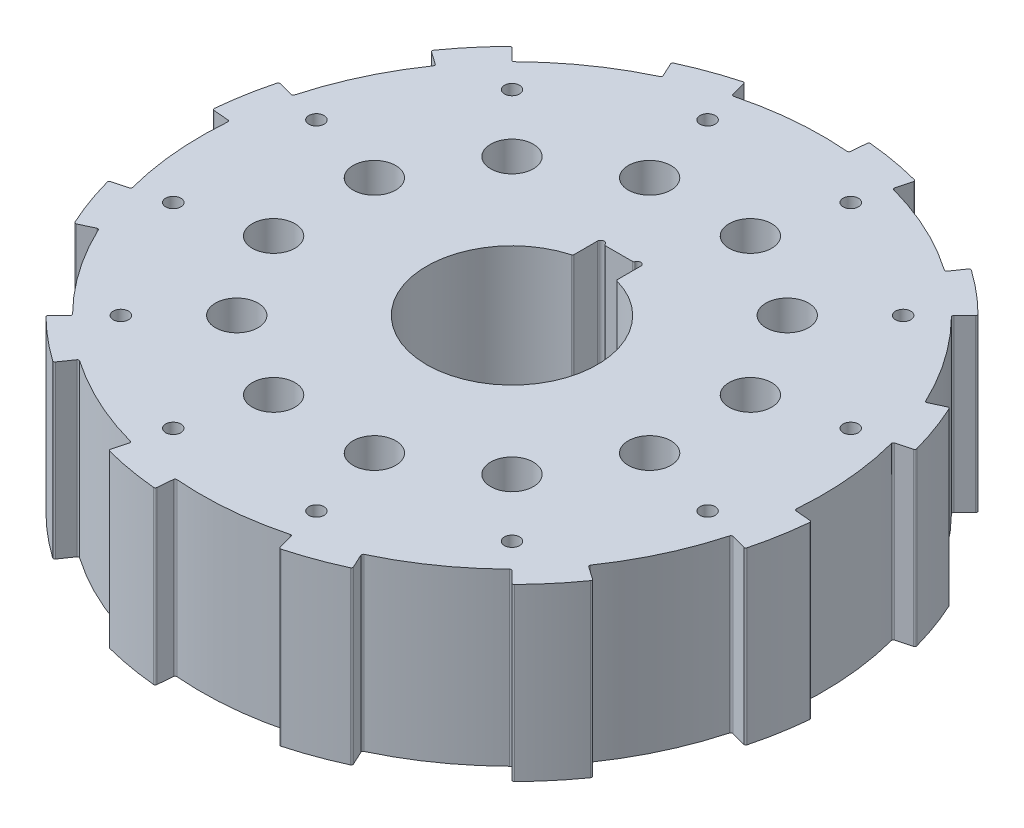
from build123d import *

# Parameters (mm, degrees)
SKETCH1_R           = 3.175
SKETCH1_R_2         = 1.1303
BOSS_EXTRUDE2_DEPTH = 25.4


with BuildPart() as part:
    # Sketch1 → Boss-Extrude2 (new body)
    with BuildSketch(Plane(origin=(0, 0, 0), x_dir=(1, 0, 0), z_dir=(0, 1, 0))):
        with BuildLine():
            Line((4.051112749, 46.304430603), (4.250353612, 48.581764091))
            ThreePointArc((4.250353612, 48.581764091), (4.340626274, 48.75462634), (4.526842206, 48.812541254))
            ThreePointArc((4.526842206, 48.812541254), (8.512578924, 48.277246028), (12.441028128, 47.41705709))
            ThreePointArc((12.441028128, 47.41705709), (12.59620747, 47.298942373), (12.621910232, 47.105626356))
            Line((12.621910232, 47.105626356), (12.03025003, 44.897519881))
            ThreePointArc((12.03025003, 44.897519881), (12.055281097, 44.705361767), (12.208533547, 44.586765891))
            ThreePointArc((12.208533547, 44.586765891), (19.536806819, 41.896791802), (26.307967962, 38.012087626))
            ThreePointArc((26.307967962, 38.012087626), (26.497307157, 37.970925526), (26.660581856, 38.075256836))
            Line((26.660581856, 38.075256836), (27.971796248, 39.947865057))
            ThreePointArc((27.971796248, 39.947865057), (28.136405792, 40.052431825), (28.326630976, 40.009479646))
            ThreePointArc((28.326630976, 40.009479646), (31.510732614, 37.553032023), (34.482774953, 34.843861949))
            ThreePointArc((34.482774953, 34.843861949), (34.558106847, 34.663981932), (34.483708083, 34.483713969))
            Line((34.483708083, 34.483713969), (32.86726208, 32.867267769))
            ThreePointArc((32.86726208, 32.867267769), (32.792860563, 32.688338427), (32.86628314, 32.509005161))
            ThreePointArc((32.86628314, 32.509005161), (37.867766915, 26.515282628), (41.78941239, 19.765449554))
            ThreePointArc((41.78941239, 19.765449554), (41.932803893, 19.635132532), (42.126369585, 19.643848748))
            Line((42.126369585, 19.643848748), (44.198218669, 20.609967842))
            ThreePointArc((44.198218669, 20.609967842), (44.393058099, 20.618220548), (44.536321852, 20.485910277))
            ThreePointArc((44.536321852, 20.485910277), (46.065610947, 16.766513415), (47.284890077, 12.934282137))
            ThreePointArc((47.284890077, 12.934282137), (47.260189402, 12.740835526), (47.105624201, 12.621918273))
            Line((47.105624201, 12.621918273), (44.897517799, 12.030257801))
            ThreePointArc((44.897517799, 12.030257801), (44.743619524, 11.912501204), (44.717538708, 11.720482751))
            ThreePointArc((44.717538708, 11.720482751), (46.052089447, 4.029024887), (46.073417516, -3.777324764))
            ThreePointArc((46.073417516, -3.777324764), (46.132439689, -3.961878367), (46.304430603, -4.051112749))
            Line((46.304430603, -4.051112749), (48.581764091, -4.250353612))
            ThreePointArc((48.581764091, -4.250353612), (48.75462634, -4.340626274), (48.812541254, -4.526842206))
            ThreePointArc((48.812541254, -4.526842206), (48.277246028, -8.512578924), (47.41705709, -12.441028128))
            ThreePointArc((47.41705709, -12.441028128), (47.298942373, -12.59620747), (47.105626356, -12.621910232))
            Line((47.105626356, -12.621910232), (44.897519881, -12.03025003))
            ThreePointArc((44.897519881, -12.03025003), (44.705361767, -12.055281097), (44.586765891, -12.208533547))
            ThreePointArc((44.586765891, -12.208533547), (41.896791802, -19.536806819), (38.012087626, -26.307967962))
            ThreePointArc((38.012087626, -26.307967962), (37.970925526, -26.497307157), (38.075256836, -26.660581856))
            Line((38.075256836, -26.660581856), (39.947865057, -27.971796248))
            ThreePointArc((39.947865057, -27.971796248), (40.052431825, -28.136405792), (40.009479646, -28.326630976))
            ThreePointArc((40.009479646, -28.326630976), (37.553032023, -31.510732614), (34.843861949, -34.482774953))
            ThreePointArc((34.843861949, -34.482774953), (34.663981932, -34.558106847), (34.483713969, -34.483708083))
            Line((34.483713969, -34.483708083), (32.867267769, -32.86726208))
            ThreePointArc((32.867267769, -32.86726208), (32.688338427, -32.792860563), (32.509005161, -32.86628314))
            ThreePointArc((32.509005161, -32.86628314), (26.515282628, -37.867766915), (19.765449554, -41.78941239))
            ThreePointArc((19.765449554, -41.78941239), (19.635132532, -41.932803893), (19.643848748, -42.126369585))
            Line((19.643848748, -42.126369585), (20.609967842, -44.198218669))
            ThreePointArc((20.609967842, -44.198218669), (20.618220548, -44.393058099), (20.485910277, -44.536321852))
            ThreePointArc((20.485910277, -44.536321852), (16.766513415, -46.065610947), (12.934282137, -47.284890077))
            ThreePointArc((12.934282137, -47.284890077), (12.740835526, -47.260189402), (12.621918273, -47.105624201))
            Line((12.621918273, -47.105624201), (12.030257801, -44.897517799))
            ThreePointArc((12.030257801, -44.897517799), (11.912501204, -44.743619524), (11.720482751, -44.717538708))
            ThreePointArc((11.720482751, -44.717538708), (4.029024887, -46.052089447), (-3.777324764, -46.073417516))
            ThreePointArc((-3.777324764, -46.073417516), (-3.961878367, -46.132439689), (-4.051112749, -46.304430603))
            Line((-4.051112749, -46.304430603), (-4.250353612, -48.581764091))
            ThreePointArc((-4.250353612, -48.581764091), (-4.340626274, -48.75462634), (-4.526842206, -48.812541254))
            ThreePointArc((-4.526842206, -48.812541254), (-8.512578924, -48.277246028), (-12.441028128, -47.41705709))
            ThreePointArc((-12.441028128, -47.41705709), (-12.59620747, -47.298942373), (-12.621910232, -47.105626356))
            Line((-12.621910232, -47.105626356), (-12.03025003, -44.897519881))
            ThreePointArc((-12.03025003, -44.897519881), (-12.055281097, -44.705361767), (-12.208533547, -44.586765891))
            ThreePointArc((-12.208533547, -44.586765891), (-19.536806819, -41.896791802), (-26.307967962, -38.012087626))
            ThreePointArc((-26.307967962, -38.012087626), (-26.497307157, -37.970925526), (-26.660581856, -38.075256836))
            Line((-26.660581856, -38.075256836), (-27.971796248, -39.947865057))
            ThreePointArc((-27.971796248, -39.947865057), (-28.136405792, -40.052431825), (-28.326630976, -40.009479646))
            ThreePointArc((-28.326630976, -40.009479646), (-31.510732614, -37.553032023), (-34.482774953, -34.843861949))
            ThreePointArc((-34.482774953, -34.843861949), (-34.558106847, -34.663981932), (-34.483708083, -34.483713969))
            Line((-34.483708083, -34.483713969), (-32.86726208, -32.867267769))
            ThreePointArc((-32.86726208, -32.867267769), (-32.792860563, -32.688338427), (-32.86628314, -32.509005161))
            ThreePointArc((-32.86628314, -32.509005161), (-37.867766915, -26.515282628), (-41.78941239, -19.765449554))
            ThreePointArc((-41.78941239, -19.765449554), (-41.932803893, -19.635132532), (-42.126369585, -19.643848748))
            Line((-42.126369585, -19.643848748), (-44.198218669, -20.609967842))
            ThreePointArc((-44.198218669, -20.609967842), (-44.393058099, -20.618220548), (-44.536321852, -20.485910277))
            ThreePointArc((-44.536321852, -20.485910277), (-46.065610947, -16.766513415), (-47.284890077, -12.934282137))
            ThreePointArc((-47.284890077, -12.934282137), (-47.260189402, -12.740835526), (-47.105624201, -12.621918273))
            Line((-47.105624201, -12.621918273), (-44.897517799, -12.030257801))
            ThreePointArc((-44.897517799, -12.030257801), (-44.743619524, -11.912501204), (-44.717538708, -11.720482751))
            ThreePointArc((-44.717538708, -11.720482751), (-46.052089447, -4.029024887), (-46.073417516, 3.777324764))
            ThreePointArc((-46.073417516, 3.777324764), (-46.132439689, 3.961878367), (-46.304430603, 4.051112749))
            Line((-46.304430603, 4.051112749), (-48.581764091, 4.250353612))
            ThreePointArc((-48.581764091, 4.250353612), (-48.75462634, 4.340626274), (-48.812541254, 4.526842206))
            ThreePointArc((-48.812541254, 4.526842206), (-48.277246028, 8.512578924), (-47.41705709, 12.441028128))
            ThreePointArc((-47.41705709, 12.441028128), (-47.298942373, 12.59620747), (-47.105626356, 12.621910232))
            Line((-47.105626356, 12.621910232), (-44.897519881, 12.03025003))
            ThreePointArc((-44.897519881, 12.03025003), (-44.705361767, 12.055281097), (-44.586765891, 12.208533547))
            ThreePointArc((-44.586765891, 12.208533547), (-41.896791802, 19.536806819), (-38.012087626, 26.307967962))
            ThreePointArc((-38.012087626, 26.307967962), (-37.970925526, 26.497307157), (-38.075256836, 26.660581856))
            Line((-38.075256836, 26.660581856), (-39.947865057, 27.971796248))
            ThreePointArc((-39.947865057, 27.971796248), (-40.052431825, 28.136405792), (-40.009479646, 28.326630976))
            ThreePointArc((-40.009479646, 28.326630976), (-37.553032023, 31.510732614), (-34.843861949, 34.482774953))
            ThreePointArc((-34.843861949, 34.482774953), (-34.663981932, 34.558106847), (-34.483713969, 34.483708083))
            Line((-34.483713969, 34.483708083), (-32.867267769, 32.86726208))
            ThreePointArc((-32.867267769, 32.86726208), (-32.688338427, 32.792860563), (-32.509005161, 32.86628314))
            ThreePointArc((-32.509005161, 32.86628314), (-26.515282628, 37.867766915), (-19.765449554, 41.78941239))
            ThreePointArc((-19.765449554, 41.78941239), (-19.635132532, 41.932803893), (-19.643848748, 42.126369585))
            Line((-19.643848748, 42.126369585), (-20.609967842, 44.198218669))
            ThreePointArc((-20.609967842, 44.198218669), (-20.618220548, 44.393058099), (-20.485910277, 44.536321852))
            ThreePointArc((-20.485910277, 44.536321852), (-16.766513415, 46.065610947), (-12.934282137, 47.284890077))
            ThreePointArc((-12.934282137, 47.284890077), (-12.740835526, 47.260189402), (-12.621918273, 47.105624201))
            Line((-12.621918273, 47.105624201), (-12.030257801, 44.897517799))
            ThreePointArc((-12.030257801, 44.897517799), (-11.912501204, 44.743619524), (-11.720482751, 44.717538708))
            ThreePointArc((-11.720482751, 44.717538708), (-4.029024887, 46.052089447), (3.777324764, 46.073417516))
            ThreePointArc((3.777324764, 46.073417516), (3.961878367, 46.132439689), (4.051112749, 46.304430603))
        make_face()
        with Locations(Location((7.49436427, 27.969348226, 0), (0, 0, 270))):
            Circle(SKETCH1_R, mode=Mode.SUBTRACT)
        with Locations(Location((20.474983956, 20.474983956, 0), (0, 0, 270))):
            Circle(SKETCH1_R, mode=Mode.SUBTRACT)
        with Locations(Location((27.969348226, 7.49436427, 0), (0, 0, 270))):
            Circle(SKETCH1_R, mode=Mode.SUBTRACT)
        with Locations(Location((27.969348226, -7.49436427, 0), (0, 0, 270))):
            Circle(SKETCH1_R, mode=Mode.SUBTRACT)
        with Locations(Location((20.474983956, -20.474983956, 0), (0, 0, 270))):
            Circle(SKETCH1_R, mode=Mode.SUBTRACT)
        with Locations(Location((7.49436427, -27.969348226, 0), (0, 0, 270))):
            Circle(SKETCH1_R, mode=Mode.SUBTRACT)
        with Locations(Location((-7.49436427, -27.969348226, 0), (0, 0, 270))):
            Circle(SKETCH1_R, mode=Mode.SUBTRACT)
        with Locations(Location((-20.474983956, -20.474983956, 0), (0, 0, 270))):
            Circle(SKETCH1_R, mode=Mode.SUBTRACT)
        with Locations(Location((-27.969348226, -7.49436427, 0), (0, 0, 270))):
            Circle(SKETCH1_R, mode=Mode.SUBTRACT)
        with Locations(Location((-27.969348226, 7.49436427, 0), (0, 0, 270))):
            Circle(SKETCH1_R, mode=Mode.SUBTRACT)
        with Locations(Location((-20.474983956, 20.474983956, 0), (0, 0, 270))):
            Circle(SKETCH1_R, mode=Mode.SUBTRACT)
        with Locations(Location((-7.49436427, 27.969348226, 0), (0, 0, 270))):
            Circle(SKETCH1_R, mode=Mode.SUBTRACT)
        with Locations(Location((10.649886068, 39.7459159, 0), (0, 0, 270))):
            Circle(SKETCH1_R_2, mode=Mode.SUBTRACT)
        with Locations(Location((29.096029832, 29.096029832, 0), (0, 0, 270))):
            Circle(SKETCH1_R_2, mode=Mode.SUBTRACT)
        with Locations(Location((39.7459159, 10.649886068, 0), (0, 0, 270))):
            Circle(SKETCH1_R_2, mode=Mode.SUBTRACT)
        with Locations(Location((39.7459159, -10.649886068, 0), (0, 0, 270))):
            Circle(SKETCH1_R_2, mode=Mode.SUBTRACT)
        with Locations(Location((29.096029832, -29.096029832, 0), (0, 0, 270))):
            Circle(SKETCH1_R_2, mode=Mode.SUBTRACT)
        with Locations(Location((10.649886068, -39.7459159, 0), (0, 0, 270))):
            Circle(SKETCH1_R_2, mode=Mode.SUBTRACT)
        with Locations(Location((-10.649886068, -39.7459159, 0), (0, 0, 270))):
            Circle(SKETCH1_R_2, mode=Mode.SUBTRACT)
        with Locations(Location((-29.096029832, -29.096029832, 0), (0, 0, 270))):
            Circle(SKETCH1_R_2, mode=Mode.SUBTRACT)
        with Locations(Location((-39.7459159, -10.649886068, 0), (0, 0, 270))):
            Circle(SKETCH1_R_2, mode=Mode.SUBTRACT)
        with Locations(Location((-39.7459159, 10.649886068, 0), (0, 0, 270))):
            Circle(SKETCH1_R_2, mode=Mode.SUBTRACT)
        with Locations(Location((-29.096029832, 29.096029832, 0), (0, 0, 270))):
            Circle(SKETCH1_R_2, mode=Mode.SUBTRACT)
        with Locations(Location((-10.649886068, 39.7459159, 0), (0, 0, 270))):
            Circle(SKETCH1_R_2, mode=Mode.SUBTRACT)
        with BuildLine():
            Line((3.2258, 12.47786472), (3.2258, 15.9258))
            ThreePointArc((3.2258, 15.9258), (2.803703805, 16.426484068), (2.238853007, 16.095133333))
            ThreePointArc((2.238853007, 16.095133333), (2.146026479, 15.972409868), (1.99937951, 15.9258))
            Line((1.99937951, 15.9258), (-1.99937951, 15.9258))
            ThreePointArc((-1.99937951, 15.9258), (-2.146026479, 15.972409868), (-2.238853007, 16.095133333))
            ThreePointArc((-2.238853007, 16.095133333), (-2.803703805, 16.426484068), (-3.2258, 15.9258))
            Line((-3.2258, 15.9258), (-3.2258, 12.47786472))
            ThreePointArc((-3.2258, 12.47786472), (-3.27750471, 12.32426584), (-3.411568627, 12.233200705))
            ThreePointArc((-3.411568627, 12.233200705), (0, -12.7), (3.411568627, 12.233200705))
            ThreePointArc((3.411568627, 12.233200705), (3.27750471, 12.32426584), (3.2258, 12.47786472))
        make_face(mode=Mode.SUBTRACT)
    extrude(amount=BOSS_EXTRUDE2_DEPTH)


solid = part.part
